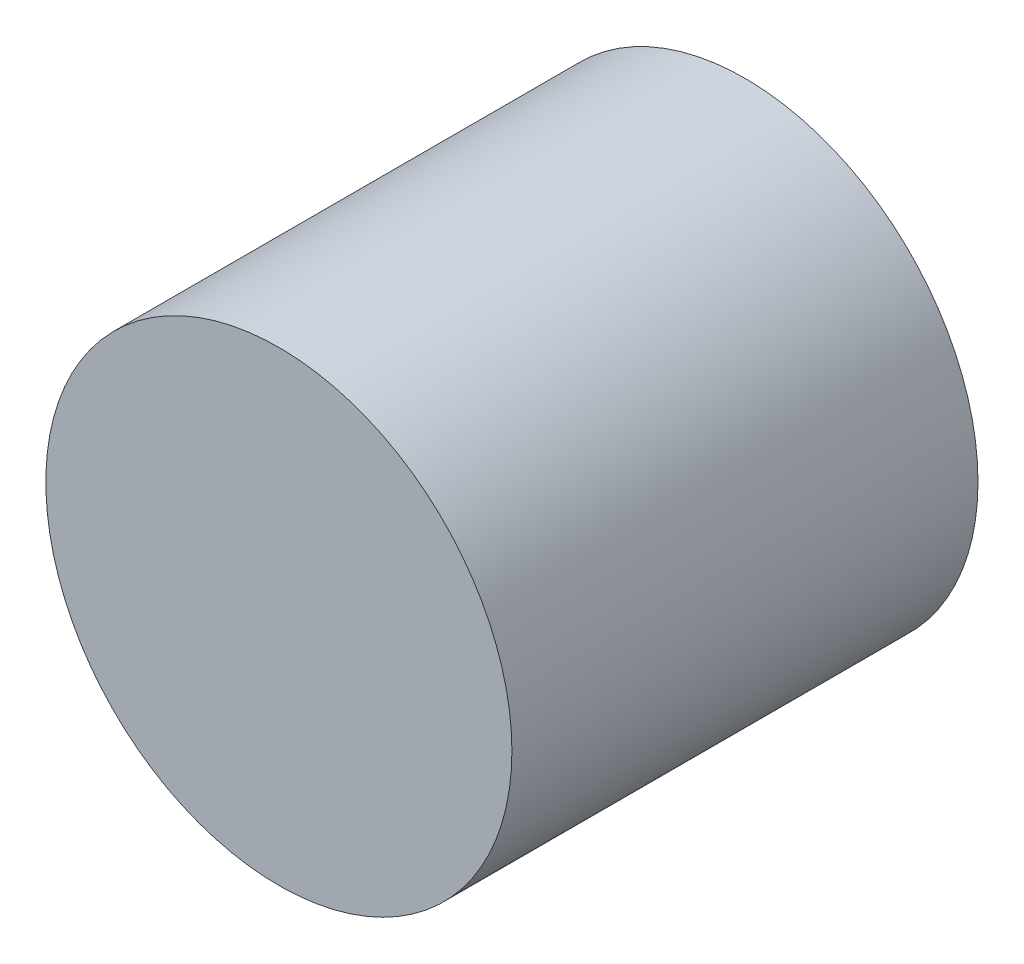
from build123d import *

# Parameters (mm, degrees)
SKETCH1_R           = 1.5
BOSS_EXTRUDE1_DEPTH = 3


with BuildPart() as part:
    # Sketch1 → Boss-Extrude1 (new body)
    with BuildSketch(Plane.XY):
        Circle(SKETCH1_R)
    extrude(amount=-BOSS_EXTRUDE1_DEPTH)


solid = part.part
